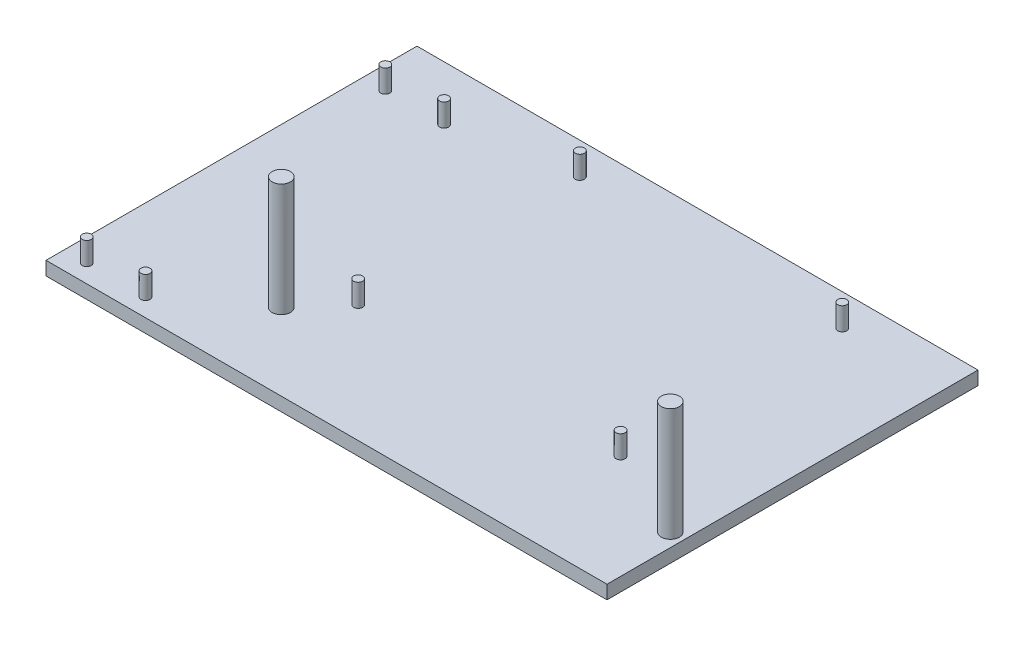
from build123d import *

# Parameters (mm, degrees)
SKETCH7_W           = 124
SKETCH7_H           = 82
BOSS_EXTRUDE3_DEPTH = 3
SKETCH8_R           = 2
BOSS_EXTRUDE4_DEPTH = 25
SKETCH9_R           = 1
BOSS_EXTRUDE5_DEPTH = 5
SKETCH10_R          = 1
BOSS_EXTRUDE6_DEPTH = 5


with BuildPart() as part:
    # Sketch7 → Boss-Extrude3 (new body)
    with BuildSketch(Plane(origin=(0, 0, 0), x_dir=(1, 0, 0), z_dir=(0, 1, 0))):
        Rectangle(SKETCH7_W, SKETCH7_H)
    extrude(amount=BOSS_EXTRUDE3_DEPTH)

    # Sketch8 → Boss-Extrude4 (add)
    with BuildSketch(Plane(origin=(0, 3, 0), x_dir=(1, 0, 0), z_dir=(0, 1, 0))):
        with Locations(Location((59, -24, 0), (0, 0, 90))):
            Circle(SKETCH8_R)
        with Locations(Location((-27, -24, 0), (0, 0, 90))):
            Circle(SKETCH8_R)
    extrude(amount=BOSS_EXTRUDE4_DEPTH)

    # Sketch9 → Boss-Extrude5 (add)
    with BuildSketch(Plane(origin=(0, 3, 0), x_dir=(1, 0, 0), z_dir=(0, 1, 0))):
        with Locations(Location((39, 34, 0), (0, 0, 90))):
            Circle(SKETCH9_R)
        with Locations(Location((-19, 34, 0), (0, 0, 90))):
            Circle(SKETCH9_R)
        with Locations(Location((-19, -15, 0), (0, 0, 90))):
            Circle(SKETCH9_R)
        with Locations(Location((39, -15, 0), (0, 0, 90))):
            Circle(SKETCH9_R)
    extrude(amount=BOSS_EXTRUDE5_DEPTH)

    # Sketch10 → Boss-Extrude6 (add)
    with BuildSketch(Plane(origin=(0, 3, 0), x_dir=(1, 0, 0), z_dir=(0, 1, 0))):
        with Locations(Location((-57, -37, 0), (0, 0, 90))):
            Circle(SKETCH10_R)
        with Locations(Location((-44, -37, 0), (0, 0, 90))):
            Circle(SKETCH10_R)
        with Locations(Location((-44, 29, 0), (0, 0, 90))):
            Circle(SKETCH10_R)
        with Locations(Location((-57, 29, 0), (0, 0, 90))):
            Circle(SKETCH10_R)
    extrude(amount=BOSS_EXTRUDE6_DEPTH)


solid = part.part
